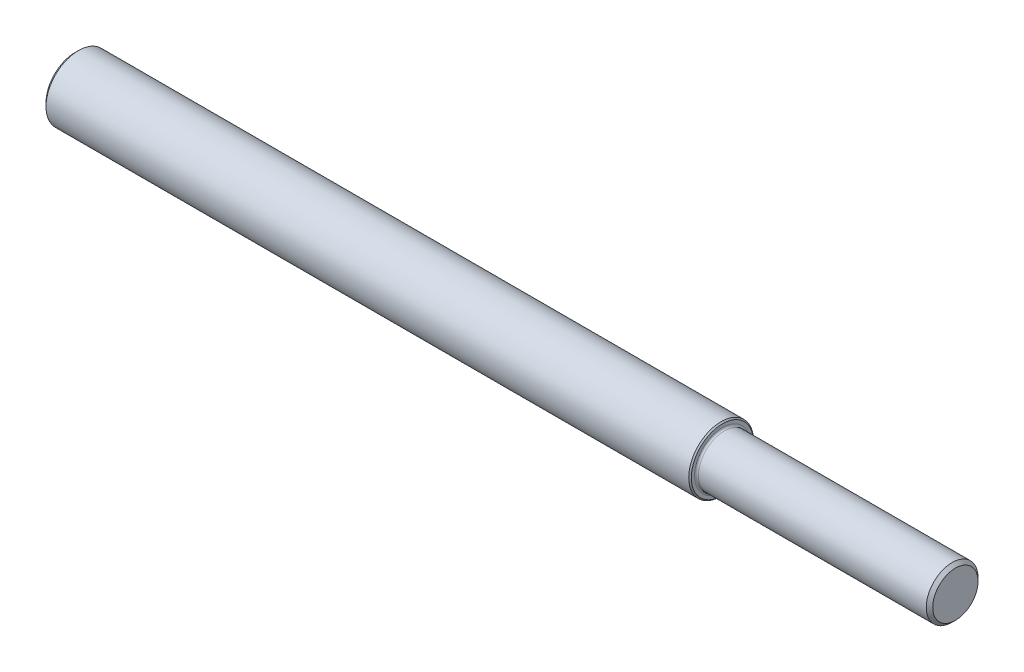
from build123d import *


with BuildPart() as part:
    # Sketch1 → Revolve1 (revolve)
    with BuildSketch(Plane.XY, mode=Mode.PRIVATE) as revolve1_sk:
        with BuildLine():
            Line((0, 0), (0, 4.5))
            Line((0, 4.5), (0.5, 5))
            Line((0.5, 5), (99.8, 5))
            Line((99.8, 5), (100, 4.8))
            Line((100, 4.8), (100, 4.3))
            ThreePointArc((100, 4.3), (100.087867966, 4.087867966), (100.3, 4))
            Line((100.3, 4), (135.5, 4))
            Line((135.5, 4), (136, 3.5))
            Line((136, 3.5), (136, 0))
            Line((136, 0), (0, 0))
        make_face()
    revolve(revolve1_sk.sketch.rotate(Axis((136, 0, 0), (-1, 0, 0)), 270), axis=Axis((136, 0, 0), (-1, 0, 0)))


solid = part.part
